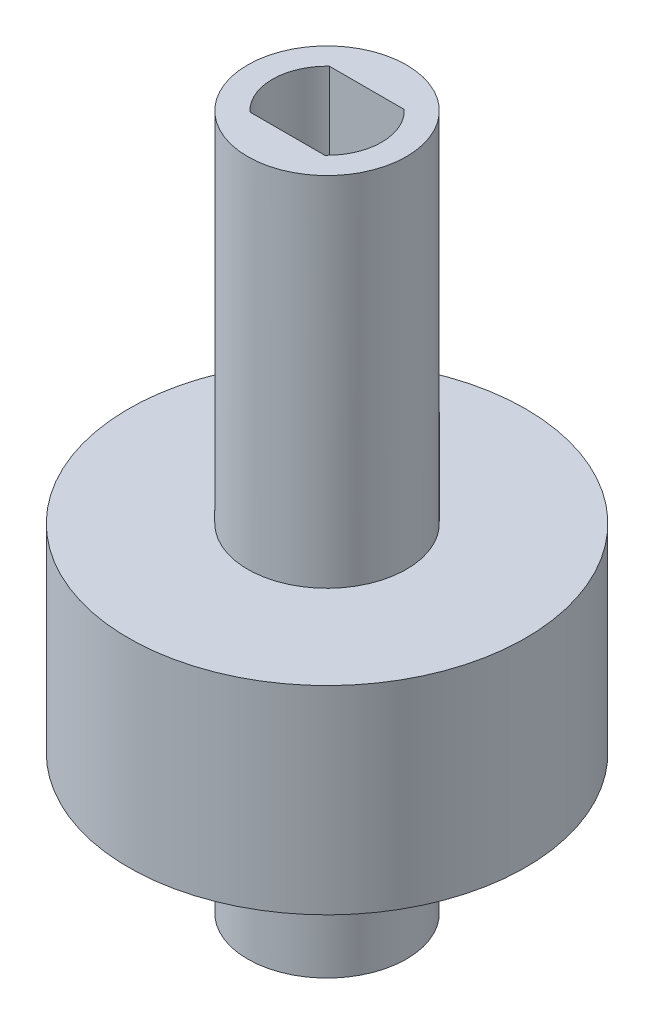
from build123d import *

# Parameters (mm, degrees)
SKETCH1_R           = 4
BOSS_EXTRUDE1_DEPTH = 35
CUT_EXTRUDE1_DEPTH  = 10
SKETCH3_R           = 2.4
CUT_EXTRUDE2_DEPTH  = 15
BOSS_EXTRUDE2_START = -7
SKETCH4_R           = 10
SKETCH4_R_2         = 4
BOSS_EXTRUDE2_DEPTH = 10


with BuildPart() as part:
    # Sketch1 → Boss-Extrude1 (new body)
    with BuildSketch(Plane(origin=(0, 0, 0), x_dir=(1, 0, 0), z_dir=(0, 1, 0))):
        with Locations(Location((0, 0, 0), (0, 0, 270))):
            Circle(SKETCH1_R)
    extrude(amount=BOSS_EXTRUDE1_DEPTH)

    # Sketch2 → Cut-Extrude1 (cut)
    with BuildSketch(Plane(origin=(0, 35, 0), x_dir=(1, 0, 0), z_dir=(0, 1, 0))):
        with BuildLine():
            Line((-1.887458609, 2), (1.887458609, 2))
            ThreePointArc((1.887458609, 2), (2.75, 0), (1.887458609, -2))
            Line((1.887458609, -2), (-1.887458609, -2))
            ThreePointArc((-1.887458609, -2), (-2.75, 0), (-1.887458609, 2))
        make_face()
    extrude(amount=-CUT_EXTRUDE1_DEPTH, mode=Mode.SUBTRACT)

    # Sketch3 → Cut-Extrude2 (cut)
    with BuildSketch(Plane(origin=(0, 0, 0), x_dir=(-1, 0, 0), z_dir=(0, -1, 0))):
        with Locations(Location((0, 0, 0), (0, 0, 90))):
            Circle(SKETCH3_R)
    extrude(amount=-CUT_EXTRUDE2_DEPTH, mode=Mode.SUBTRACT)

    # Sketch4 → Boss-Extrude2 (add)
    with BuildSketch(Plane.XZ.offset(BOSS_EXTRUDE2_START)):
        with Locations(Location((0, 0, 0), (0, 0, 270))):
            Circle(SKETCH4_R)
        with Locations(Location((0, 0, 0), (0, 0, 270))):
            Circle(SKETCH4_R_2, mode=Mode.SUBTRACT)
    extrude(amount=-BOSS_EXTRUDE2_DEPTH)


solid = part.part
